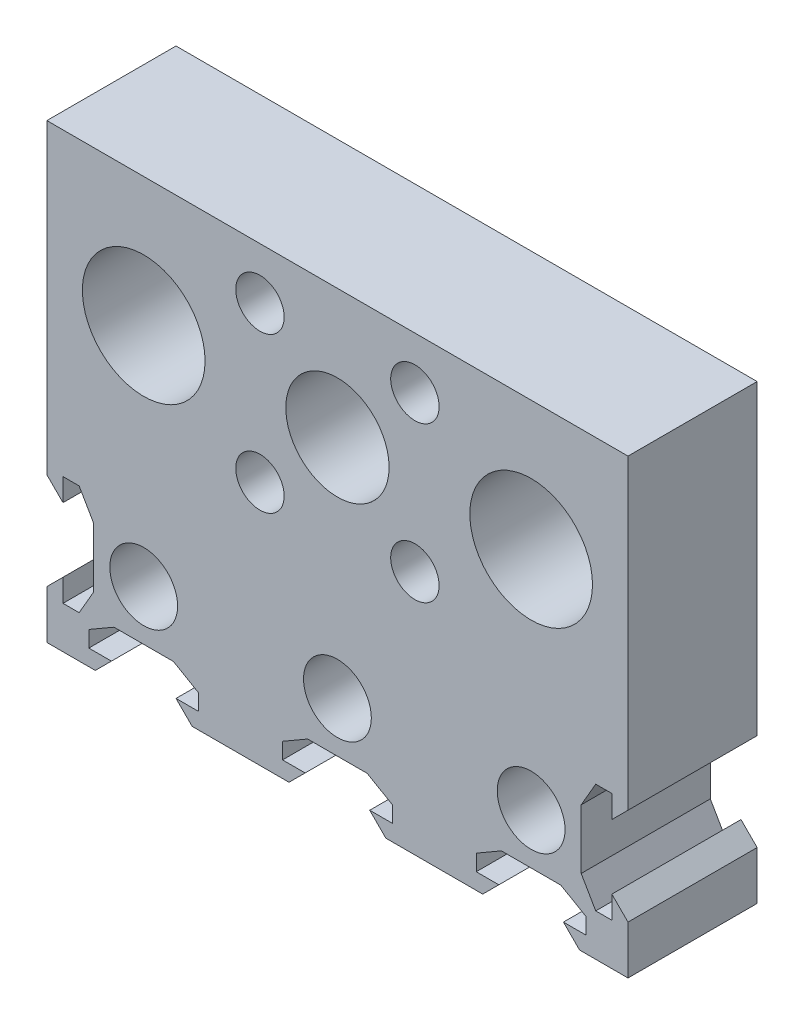
from build123d import *

# Parameters (mm, degrees)
SKETCH1_R           = 5.25
SKETCH1_R_2         = 8
SKETCH1_R_3         = 9.5
SKETCH1_R_4         = 3.75
BOSS_EXTRUDE1_DEPTH = 10


with BuildPart() as part:
    # Sketch1 → Boss-Extrude1 (new, symmetric)
    with BuildSketch(Plane.XY):
        Polygon((45, 70), (-45, 70), (-45, 22.5), (-42.5, 20), (-42.5, 23.5), (-40, 23.5), (-37.75, 19.602885683), (-37.75, 10.397114317), (-40, 6.5), (-42.5, 6.5), (-42.5, 10), (-45, 7.5), (-45, 0), (-37.5, 0), (-35, 2.5), (-38.5, 2.5), (-38.5, 5), (-34.602885683, 7.25), (-25.397114317, 7.25), (-21.5, 5), (-21.5, 2.5), (-25, 2.5), (-22.5, 0), (-7.5, 0), (-5, 2.5), (-8.5, 2.5), (-8.5, 5), (-4.602885683, 7.25), (4.602885683, 7.25), (8.5, 5), (8.5, 2.5), (5, 2.5), (7.5, 0), (22.5, 0), (25, 2.5), (21.5, 2.5), (21.5, 5), (25.397114317, 7.25), (34.602885683, 7.25), (38.5, 5), (38.5, 2.5), (35, 2.5), (37.5, 0), (45, 0), (45, 7.5), (42.5, 10), (42.5, 6.5), (40, 6.5), (37.75, 10.397114317), (37.75, 19.602885683), (40, 23.5), (42.5, 23.5), (42.5, 20), (45, 22.5), align=None)
        with Locations((0, 15)):
            Circle(SKETCH1_R, mode=Mode.SUBTRACT)
        with Locations((-30, 15)):
            Circle(SKETCH1_R, mode=Mode.SUBTRACT)
        with Locations((30, 15)):
            Circle(SKETCH1_R, mode=Mode.SUBTRACT)
        with Locations((0, 50)):
            Circle(SKETCH1_R_2, mode=Mode.SUBTRACT)
        with Locations((30, 50)):
            Circle(SKETCH1_R_3, mode=Mode.SUBTRACT)
        with Locations((12, 62)):
            Circle(SKETCH1_R_4, mode=Mode.SUBTRACT)
        with Locations((12, 38)):
            Circle(SKETCH1_R_4, mode=Mode.SUBTRACT)
        with Locations((-12, 38)):
            Circle(SKETCH1_R_4, mode=Mode.SUBTRACT)
        with Locations((-12, 62)):
            Circle(SKETCH1_R_4, mode=Mode.SUBTRACT)
        with Locations((-30, 50)):
            Circle(SKETCH1_R_3, mode=Mode.SUBTRACT)
    extrude(amount=BOSS_EXTRUDE1_DEPTH, both=True)


solid = part.part
